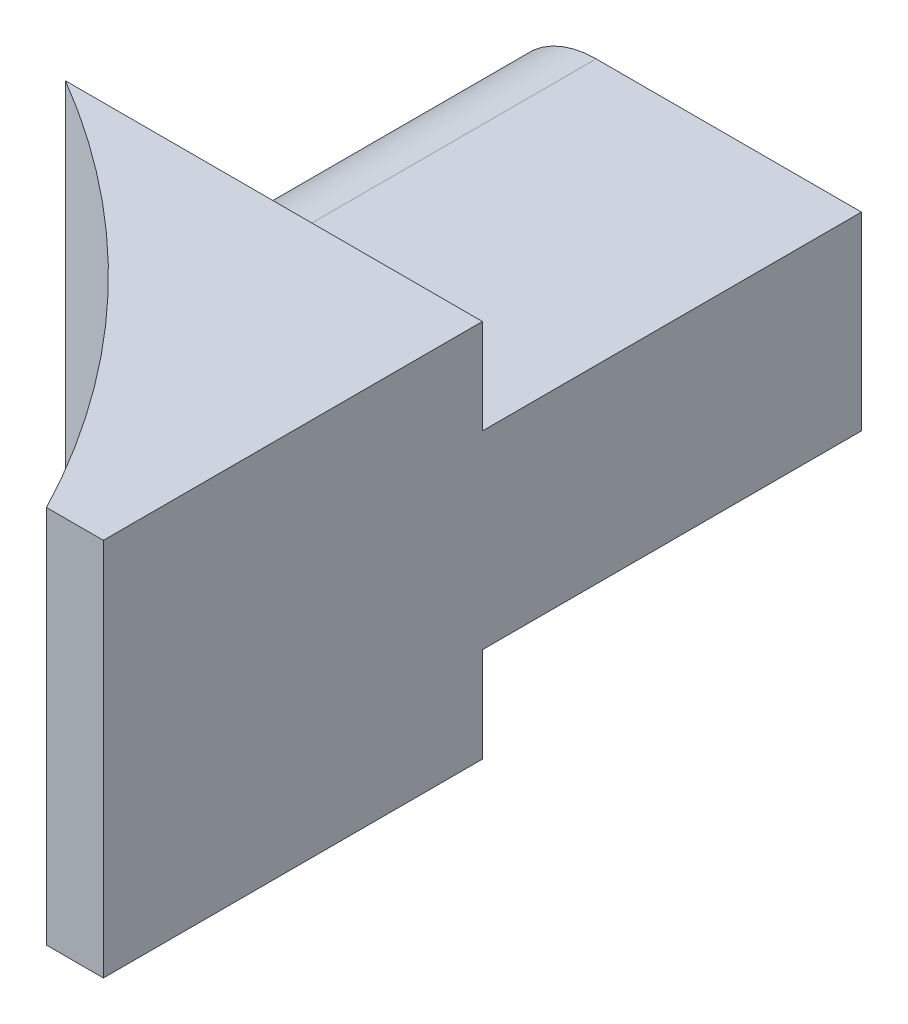
from build123d import *

# Parameters (mm, degrees)
CROQUIS1_R              = 2.5
SALIENTE_EXTRUIR1_DEPTH = 10
CROQUIS2_R              = 1.5
CORTAR_EXTRUIR1_DEPTH   = 0.9
REDONDEO1_R             = 0.1
CROQUIS3_W              = 11
CROQUIS3_H              = 10
SALIENTE_EXTRUIR2_DEPTH = 10
CORTAR_EXTRUIR2_DEPTH   = 24.430749028
SALIENTE_EXTRUIR3_DEPTH = 10


with BuildPart() as part:
    # Croquis1 → Saliente-Extruir1 (new body)
    with BuildSketch(Plane.XY):
        Circle(CROQUIS1_R)
    extrude(amount=SALIENTE_EXTRUIR1_DEPTH)

    # Croquis2 → Cortar-Extruir1 (cut)
    with BuildSketch(Plane(origin=(0, 0, 0), x_dir=(-1, 0, 0), z_dir=(0, 0, -1))):
        Circle(CROQUIS2_R)
    extrude(amount=-CORTAR_EXTRUIR1_DEPTH, mode=Mode.SUBTRACT)

    # Redondeo1
    redondeo1_edges = [part.edges().sort_by_distance(p)[0] for p in [
        (1.5, 0, 0.9),
    ]]
    fillet(redondeo1_edges, radius=REDONDEO1_R)

    # Croquis3 → Saliente-Extruir2 (add)
    with BuildSketch(Plane.XY.offset(10)):
        with Locations((1.5, 0)):
            Rectangle(CROQUIS3_W, CROQUIS3_H)
    extrude(amount=SALIENTE_EXTRUIR2_DEPTH)

    # Croquis4 → Cortar-Extruir2 (cut, through all)
    with BuildSketch(Plane.XZ.offset(5)):
        with BuildLine():
            Line((-4, 20), (-4, 10))
            ThreePointArc((-4, 10), (1.453300741, 14.331864296), (5.5, 20))
            Line((5.5, 20), (-4, 20))
        make_face()
    extrude(amount=-CORTAR_EXTRUIR2_DEPTH, mode=Mode.SUBTRACT)

    # Croquis5 → Saliente-Extruir3 (add)
    with BuildSketch(Plane(origin=(0, 0, 0), x_dir=(-1, 0, 0), z_dir=(0, 0, -1))):
        with BuildLine():
            Line((0, -2.5), (-7, -2.5))
            Line((-7, -2.5), (-7, 2.5))
            Line((-7, 2.5), (0, 2.5))
            ThreePointArc((0, 2.5), (-2.5, 0), (0, -2.5))
        make_face()
    extrude(amount=-SALIENTE_EXTRUIR3_DEPTH)


solid = part.part
